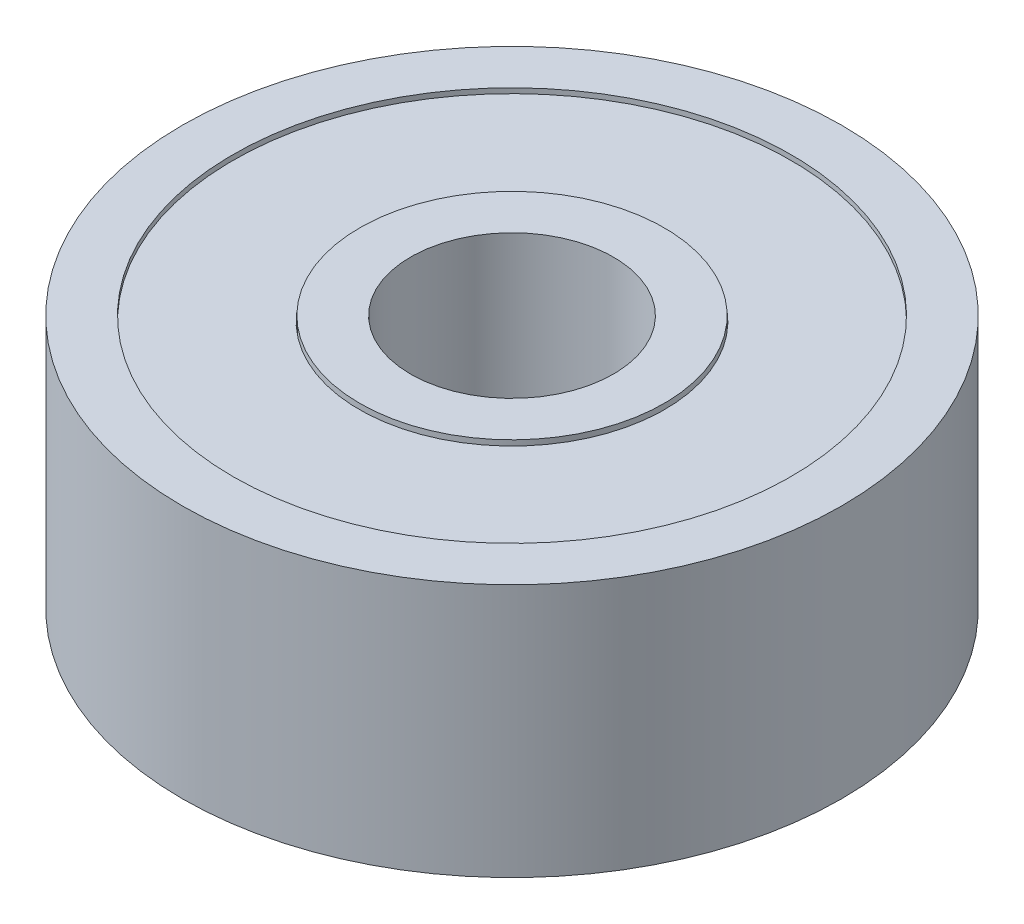
from build123d import *

# Parameters (mm, degrees)
SKETCH1_R           = 6.5
SKETCH1_R_2         = 2
BOSS_EXTRUDE1_DEPTH = 5
CUT_EXTRUDE1_REACH  = 12.464
SKETCH2_R           = 5.5
SKETCH2_R_2         = 3
BOSS_EXTRUDE2_START = -0.1
SKETCH4_R           = 5.99
SKETCH4_R_2         = 3.01
BOSS_EXTRUDE2_DEPTH = 4.8


with BuildPart() as part:
    # Sketch1 → Boss-Extrude1 (new body)
    with BuildSketch(Plane(origin=(0, 0, 0), x_dir=(1, 0, 0), z_dir=(0, 1, 0))):
        with Locations(Location((0, 0, 0), (0, 0, 270))):
            Circle(SKETCH1_R)
        with Locations(Location((0, 0, 0), (0, 0, 270))):
            Circle(SKETCH1_R_2, mode=Mode.SUBTRACT)
    extrude(amount=BOSS_EXTRUDE1_DEPTH)

    # Sketch2 → Cut-Extrude1 (cut, up to next)
    with BuildSketch(Plane(origin=(0, 5, 0), x_dir=(1, 0, 0), z_dir=(0, 1, 0)), mode=Mode.PRIVATE) as cut_extrude1_sk1:
        with Locations(Location((0, 0, 0), (0, 0, 270))):
            Circle(SKETCH2_R)
        with Locations(Location((0, 0, 0), (0, 0, 270))):
            Circle(SKETCH2_R_2, mode=Mode.SUBTRACT)
    cut_extrude1_tool1 = extrude(cut_extrude1_sk1.sketch, amount=-CUT_EXTRUDE1_REACH, mode=Mode.PRIVATE) & part.part
    add(cut_extrude1_tool1.solids().sort_by_distance((0, 5, -5.344437))[0], mode=Mode.SUBTRACT)


with BuildPart() as cut_extrude1_piece_1:
    # of the separate pieces the step leaves, piece 1, a body of its own (cut_extrude1_pieces)
    add(part.part.solids().sort_by_distance((0, 0, 6.5))[0])


with BuildPart() as cut_extrude1_piece_2:
    # of the separate pieces the step leaves, piece 2, a body of its own (cut_extrude1_pieces)
    add(part.part.solids().sort_by_distance((0, 0, 3))[0])


with BuildPart() as body_3:
    # Sketch4 → Boss-Extrude2 (new body)
    with BuildSketch(Plane.XZ.offset(BOSS_EXTRUDE2_START)):
        with Locations(Location((0, 0, 0), (0, 0, 270))):
            Circle(SKETCH4_R)
        with Locations(Location((0, 0, 0), (0, 0, 270))):
            Circle(SKETCH4_R_2, mode=Mode.SUBTRACT)
    extrude(amount=-BOSS_EXTRUDE2_DEPTH)


solid = Compound([cut_extrude1_piece_1.part, cut_extrude1_piece_2.part, body_3.part])
